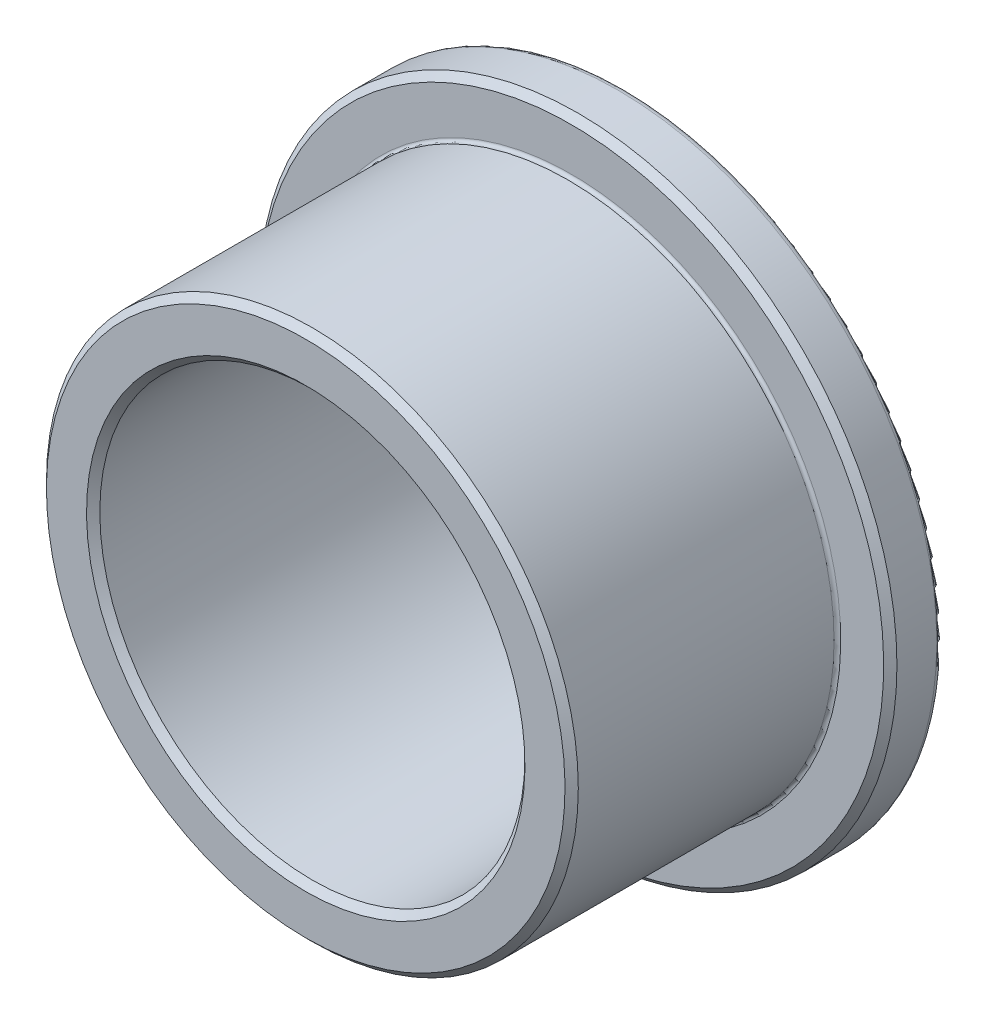
from build123d import *

# Parameters (mm, degrees)
CHAMFER1_SIZE = 0.396875
FILLET1_R     = 0.396875
FILLET2_R     = 0.1984375


with BuildPart() as part:
    # Sketch3 → Revolve1 (revolve)
    with BuildSketch(Plane(origin=(0, 0, 0), x_dir=(0, 0, -1), z_dir=(1, 0, 0))):
        Polygon((9.525, 19.05), (6.35, 19.05), (6.35, 15.8877), (-9.525, 15.8877), (-9.525, 12.7), (9.525, 12.7), align=None)
    revolve(axis=Axis((0, 0, -9.525), (0, 0, 1)))

    # Chamfer1
    chamfer1_edges = [part.edges().sort_by_distance(p)[0] for p in [
        (0, -12.7, 9.525),
        (0, -15.8877, 9.525),
        (0, -19.05, -6.35),
    ]]
    chamfer(chamfer1_edges, length=CHAMFER1_SIZE)

    # Fillet1
    fillet1_edges = [part.edges().sort_by_distance(p)[0] for p in [
        (0, -19.05, -9.525),
    ]]
    fillet(fillet1_edges, radius=FILLET1_R)

    # Fillet2
    fillet2_edges = [part.edges().sort_by_distance(p)[0] for p in [
        (0, -15.8877, -6.35),
    ]]
    fillet(fillet2_edges, radius=FILLET2_R)


solid = part.part
